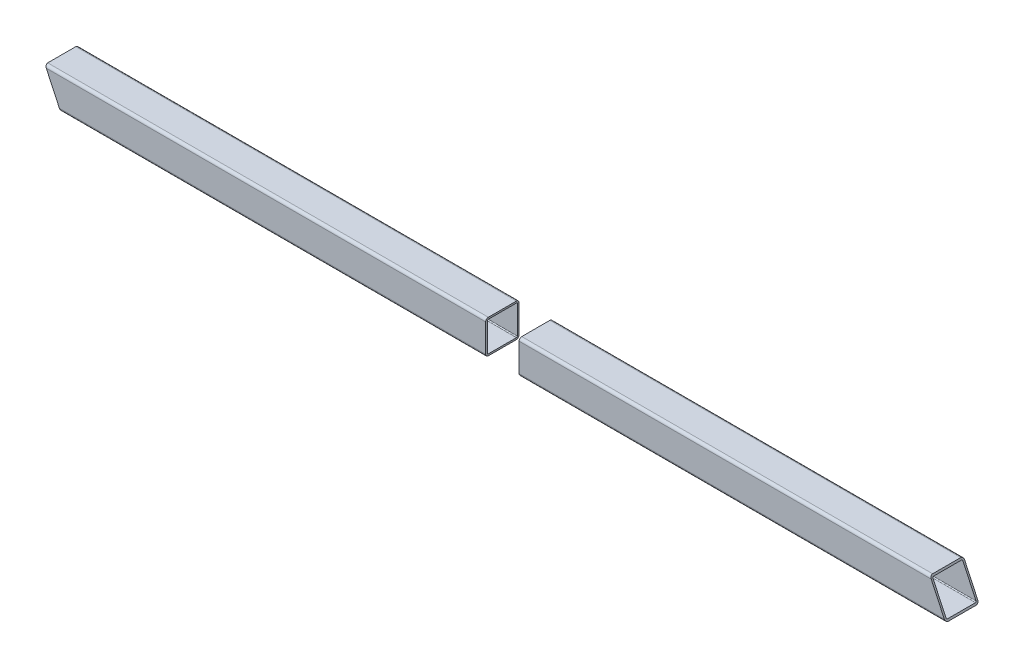
from build123d import *

# Parameters (mm, degrees)
BOSS_EXTRUDE1_DEPTH = 393.7
SCALE1_SCALE_X      = 1
SCALE1_SCALE_Y      = 0.4
SCALE1_SCALE_Z      = 0.4
SKETCH2_W           = 12.7
SKETCH2_H           = 12.7
CUT_EXTRUDE1_DEPTH  = 395.531279762


with BuildPart() as part:
    # Sketch1 → Boss-Extrude1 (new body)
    with BuildSketch(Plane(origin=(0, 0, 0), x_dir=(0, 0, -1), z_dir=(1, 0, 0))):
        with BuildLine():
            Line((0, 2.54), (0, 29.21))
            ThreePointArc((0, 29.21), (-0.743948776, 31.006051224), (-2.54, 31.75))
            Line((-2.54, 31.75), (-29.21, 31.75))
            ThreePointArc((-29.21, 31.75), (-31.006051224, 31.006051224), (-31.75, 29.21))
            Line((-31.75, 29.21), (-31.75, 2.54))
            ThreePointArc((-31.75, 2.54), (-31.006051224, 0.743948776), (-29.21, 0))
            Line((-29.21, 0), (-2.54, 0))
            ThreePointArc((-2.54, 0), (-0.743948776, 0.743948776), (0, 2.54))
        make_face()
        with BuildLine():
            Line((-1.651, 2.54), (-1.651, 29.21))
            ThreePointArc((-1.651, 29.21), (-1.911382072, 29.838617928), (-2.54, 30.099))
            Line((-2.54, 30.099), (-29.21, 30.099))
            ThreePointArc((-29.21, 30.099), (-29.838617928, 29.838617928), (-30.099, 29.21))
            Line((-30.099, 29.21), (-30.099, 2.54))
            ThreePointArc((-30.099, 2.54), (-29.838617928, 1.911382072), (-29.21, 1.651))
            Line((-29.21, 1.651), (-2.54, 1.651))
            ThreePointArc((-2.54, 1.651), (-1.911382072, 1.911382072), (-1.651, 2.54))
        make_face(mode=Mode.SUBTRACT)
    extrude(amount=BOSS_EXTRUDE1_DEPTH)


with BuildPart() as part_1:
    # Scale1: scaled about (196.85, 15.875, 15.875)
    add(part.part.scale((SCALE1_SCALE_X, SCALE1_SCALE_Y, SCALE1_SCALE_Z), about=(196.85, 15.875, 15.875)))

    # Sketch2 → Cut-Extrude1 (cut, through all)
    with BuildSketch(Plane.XY.offset(22.225)):
        Polygon((0, 22.225), (5.922107259, 9.525), (0, 9.525), align=None)
        Polygon((336.3095897, 22.225), (342.231696958, 9.525), (360.905561886, 9.525), (360.905561886, 22.225), align=None)
        with Locations((173.811106521, 15.875)):
            Rectangle(SKETCH2_W, SKETCH2_H)
    extrude(amount=-CUT_EXTRUDE1_DEPTH, mode=Mode.SUBTRACT)


with BuildPart() as cut_extrude1_piece_1:
    # of the separate pieces the step leaves, piece 1, a body of its own (cut_extrude1_pieces_kept)
    add(part_1.part.solids().sort_by_distance((0.473768581, 21.209, 9.525))[0])


with BuildPart() as cut_extrude1_piece_2:
    # of the separate pieces the step leaves, piece 2, a body of its own (cut_extrude1_pieces_kept)
    add(part_1.part.solids().sort_by_distance((180.161106521, 21.209, 9.525))[0])


solid = Compound([cut_extrude1_piece_1.part, cut_extrude1_piece_2.part])
